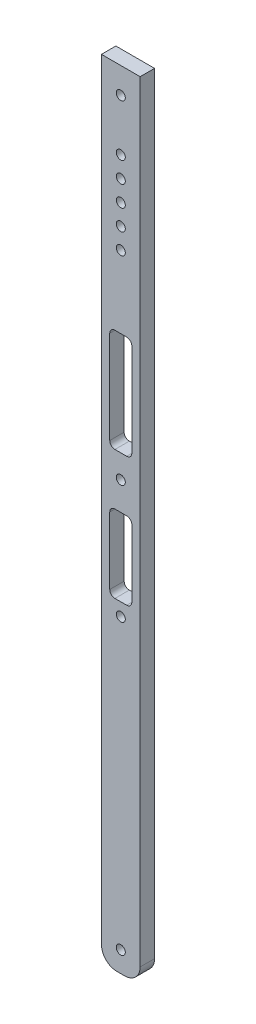
from build123d import *

# Parameters (mm, degrees)
SKETCH1_W           = 15
SKETCH1_H           = 304.8
BOSS_EXTRUDE1_DEPTH = 5.588
SKETCH2_R           = 1.75
CUT_EXTRUDE1_DEPTH  = 217.796734309
SKETCH3_R           = 1.75
CUT_EXTRUDE2_DEPTH  = 217.796734309
FILLET1_R           = 6


with BuildPart() as part:
    # Sketch1 → Boss-Extrude1 (new body)
    with BuildSketch(Plane.XY):
        with Locations((2.310829902, -64.102530885)):
            Rectangle(SKETCH1_W, SKETCH1_H)
    extrude(amount=BOSS_EXTRUDE1_DEPTH)

    # Sketch2 → Cut-Extrude1 (cut, through all)
    with BuildSketch(Plane.XY.offset(5.588)):
        with Locations((2.310829902, 78.297469115)):
            Circle(SKETCH2_R)
        with Locations((2.310829902, 58.297469115)):
            Circle(SKETCH2_R)
        with Locations((2.310829902, 50.297469115)):
            Circle(SKETCH2_R)
        with Locations((2.310829902, 42.297469115)):
            Circle(SKETCH2_R)
        with Locations((2.310829902, 34.297469115)):
            Circle(SKETCH2_R)
        with Locations((2.310829902, 26.297469115)):
            Circle(SKETCH2_R)
        with Locations((2.310829902, -50.762845209)):
            Circle(SKETCH2_R)
        with Locations((2.310829902, -96.702530885)):
            Circle(SKETCH2_R)
        with BuildLine():
            Line((0.029482749, -1.702530885), (4.592177054, -1.702530885))
            ThreePointArc((4.592177054, -1.702530885), (6.006390617, -2.288317323), (6.592177054, -3.702530885))
            Line((6.592177054, -3.702530885), (6.592177054, -39.702530885))
            ThreePointArc((6.592177054, -39.702530885), (6.006390617, -41.116744448), (4.592177054, -41.702530885))
            Line((4.592177054, -41.702530885), (0.029482749, -41.702530885))
            ThreePointArc((0.029482749, -41.702530885), (-1.384730813, -41.116744448), (-1.970517251, -39.702530885))
            Line((-1.970517251, -39.702530885), (-1.970517251, -3.702530885))
            ThreePointArc((-1.970517251, -3.702530885), (-1.384730813, -2.288317323), (0.029482749, -1.702530885))
        make_face()
        with BuildLine():
            Line((0.029482749, -61.702530885), (4.592177054, -61.702530885))
            ThreePointArc((4.592177054, -61.702530885), (6.006390617, -62.288317323), (6.592177054, -63.702530885))
            Line((6.592177054, -63.702530885), (6.592177054, -89.702530885))
            ThreePointArc((6.592177054, -89.702530885), (6.006390617, -91.116744448), (4.592177054, -91.702530885))
            Line((4.592177054, -91.702530885), (0.029482749, -91.702530885))
            ThreePointArc((0.029482749, -91.702530885), (-1.384730813, -91.116744448), (-1.970517251, -89.702530885))
            Line((-1.970517251, -89.702530885), (-1.970517251, -63.702530885))
            ThreePointArc((-1.970517251, -63.702530885), (-1.384730813, -62.288317323), (0.029482749, -61.702530885))
        make_face()
    extrude(amount=-CUT_EXTRUDE1_DEPTH, mode=Mode.SUBTRACT)

    # Sketch3 → Cut-Extrude2 (cut, through all)
    with BuildSketch(Plane.XY.offset(5.588)):
        with Locations((2.310829902, -208.502530885)):
            Circle(SKETCH3_R)
    extrude(amount=-CUT_EXTRUDE2_DEPTH, mode=Mode.SUBTRACT)

    # Fillet1
    fillet1_edges = [part.edges().sort_by_distance(p)[0] for p in [
        (9.810829902, -216.502530885, 2.794),
        (-5.189170098, -216.502530885, 2.794),
    ]]
    fillet(fillet1_edges, radius=FILLET1_R)


solid = part.part
